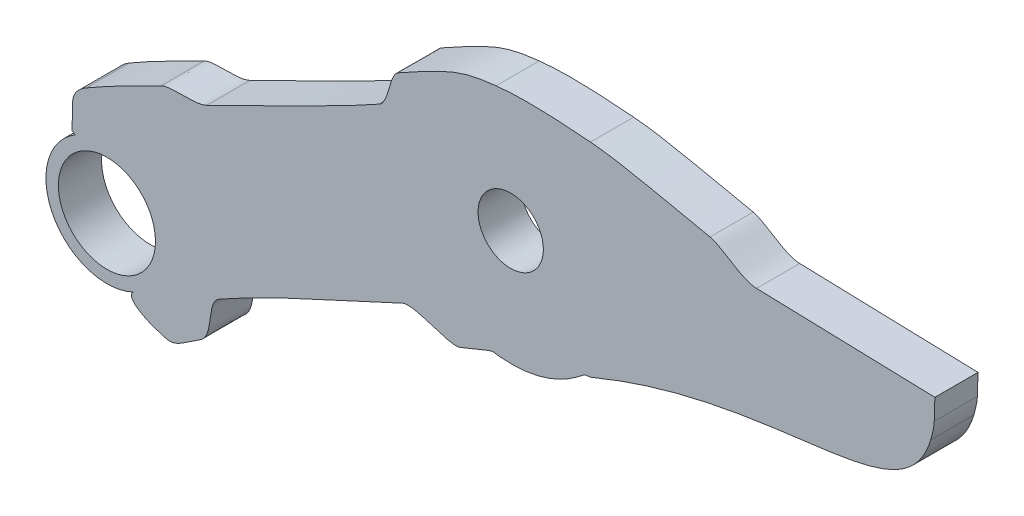
from build123d import *

# Parameters (mm, degrees)
SKETCH1_R           = 1.513948887
SKETCH1_R_2         = 2.25
BOSS_EXTRUDE1_DEPTH = 2
SCALE1_SCALE        = 2.8


with BuildPart() as part:
    # Sketch1 → Boss-Extrude1 (new body)
    with BuildSketch(Plane.XY):
        with BuildLine():
            Line((-137.330840139, 84.740646997), (-129.065622639, 84.500215059))
            Line((-129.065622639, 84.500215059), (-129.094489584, 83.519353553))
            add(Edge.make_bspline(
                [(-129.094489584, 83.519353553), (-129.101127466, 83.291204798), (-129.199889222, 82.884598348), (-129.259340655, 82.689308143)],
                knots=[0.212765957, 0.212765957, 0.212765957, 0.212765957, 0.234042553, 0.234042553, 0.234042553, 0.234042553], degree=3))
            add(Edge.make_bspline(
                [(-129.259340655, 82.689308143), (-130.523557303, 78.537033893), (-136.295329969, 80.981325314), (-144.988370325, 77.341015795)],
                knots=[0.234042553, 0.234042553, 0.234042553, 0.234042553, 0.255319149, 0.255319149, 0.255319149, 0.255319149], degree=3))
            add(Edge.make_bspline(
                [(-144.988370325, 77.341015795), (-145.098029788, 77.295108948), (-145.047490899, 77.331606959), (-145.163209238, 77.309852904)],
                knots=[0.255319149, 0.255319149, 0.255319149, 0.255319149, 0.276595745, 0.276595745, 0.276595745, 0.276595745], degree=3))
            add(Edge.make_bspline(
                [(-145.163209238, 77.309852904), (-145.220654832, 77.299037913), (-145.285896319, 77.302718732), (-145.330562439, 77.26739941)],
                knots=[0.276595745, 0.276595745, 0.276595745, 0.276595745, 0.29787234, 0.29787234, 0.29787234, 0.29787234], degree=3))
            add(Edge.make_bspline(
                [(-145.330562439, 77.26739941), (-145.851667181, 76.854361866), (-147.089249586, 75.848112745), (-149.250531504, 76.047683454)],
                knots=[0.29787234, 0.29787234, 0.29787234, 0.29787234, 0.319148936, 0.319148936, 0.319148936, 0.319148936], degree=3))
            add(Edge.make_bspline(
                [(-149.250531504, 76.047683454), (-149.579241067, 76.078019194), (-149.46315051, 76.145142448), (-149.823167715, 76.007773448)],
                knots=[0.319148936, 0.319148936, 0.319148936, 0.319148936, 0.340425532, 0.340425532, 0.340425532, 0.340425532], degree=3))
            add(Edge.make_bspline(
                [(-149.823167715, 76.007773448), (-150.230952854, 75.852269176), (-150.642170668, 75.684998689), (-151.060274508, 75.505196874)],
                knots=[0.340425532, 0.340425532, 0.340425532, 0.340425532, 0.361702128, 0.361702128, 0.361702128, 0.361702128], degree=3))
            add(Edge.make_bspline(
                [(-151.060274508, 75.505196874), (-151.574575938, 75.284016862), (-153.203689978, 76.198038715), (-153.745700946, 75.937300235)],
                knots=[0.361702128, 0.361702128, 0.361702128, 0.361702128, 0.382978723, 0.382978723, 0.382978723, 0.382978723], degree=3))
            add(Edge.make_bspline(
                [(-153.745700946, 75.937300235), (-155.594836987, 75.047762033), (-159.716630745, 73.288289093), (-162.232470675, 71.858787121)],
                knots=[0.382978723, 0.382978723, 0.382978723, 0.382978723, 0.404255319, 0.404255319, 0.404255319, 0.404255319], degree=3))
            add(Edge.make_bspline(
                [(-162.232470675, 71.858787121), (-162.860836143, 71.501768336), (-162.462583912, 70.287097997), (-163.071821528, 69.816015174)],
                knots=[0.404255319, 0.404255319, 0.404255319, 0.404255319, 0.425531915, 0.425531915, 0.425531915, 0.425531915], degree=3))
            add(Edge.make_bspline(
                [(-163.071821528, 69.816015174), (-163.094733593, 69.798293477), (-163.120271861, 69.783446128), (-163.145313839, 69.766923799)],
                knots=[0.425531915, 0.425531915, 0.425531915, 0.425531915, 0.446808511, 0.446808511, 0.446808511, 0.446808511], degree=3))
            Line((-163.145313839, 69.766923799), (-163.880340349, 69.282192995))
            add(Edge.make_bspline(
                [(-163.880340349, 69.282192995), (-164.468258164, 68.894466252), (-164.620846731, 69.006028161), (-165.195757605, 69.192653966)],
                knots=[0.468085106, 0.468085106, 0.468085106, 0.468085106, 0.489361702, 0.489361702, 0.489361702, 0.489361702], degree=3))
            add(Edge.make_bspline(
                [(-165.195757605, 69.192653966), (-165.880330422, 69.414858475), (-166.586588499, 69.876830428), (-166.216843664, 70.149863853)],
                knots=[0.489361702, 0.489361702, 0.489361702, 0.489361702, 0.509556789, 0.509556789, 0.509556789, 0.509556789], degree=3))
            ThreePointArc((-166.216843664, 70.149863853), (-169.932333673, 71.346005011), (-168.915752591, 75.114583334))
            Line((-168.915752591, 75.114583334), (-169.065622639, 75.20554687))
            Line((-169.065622639, 75.20554687), (-169.064671417, 75.244319545))
            Line((-169.064671417, 75.244319545), (-169.037168666, 76.350054178))
            add(Edge.make_bspline(
                [(-169.037168666, 76.350054178), (-169.033053593, 76.794047826), (-168.700084206, 77.078711631), (-168.409216773, 77.250221263)],
                knots=[0.957446809, 0.957446809, 0.957446809, 0.957446809, 1, 1, 1, 1], degree=3))
            add(Edge.make_bspline(
                [(-168.409216773, 77.250221263), (-167.016522993, 78.071374807), (-166.193859899, 78.40091152), (-164.934151222, 79.073281388)],
                knots=[0, 0, 0, 0, 0.021276596, 0.021276596, 0.021276596, 0.021276596], degree=3))
            add(Edge.make_bspline(
                [(-164.934151222, 79.073281388), (-164.508106737, 79.300665029), (-163.405349845, 79.062094179), (-162.816253342, 79.349694368)],
                knots=[0.021276596, 0.021276596, 0.021276596, 0.021276596, 0.042553191, 0.042553191, 0.042553191, 0.042553191], degree=3))
            add(Edge.make_bspline(
                [(-162.816253342, 79.349694368), (-160.762294186, 80.3524281), (-156.1821764, 82.606350861), (-154.813800841, 83.397685633)],
                knots=[0.042553191, 0.042553191, 0.042553191, 0.042553191, 0.063829787, 0.063829787, 0.063829787, 0.063829787], degree=3))
            add(Edge.make_bspline(
                [(-154.813800841, 83.397685633), (-154.362548949, 83.658651579), (-154.360419036, 84.858143709), (-153.955446208, 85.0823635)],
                knots=[0.063829787, 0.063829787, 0.063829787, 0.063829787, 0.085106383, 0.085106383, 0.085106383, 0.085106383], degree=3))
            add(Edge.make_bspline(
                [(-153.955446208, 85.0823635), (-151.58212429, 86.396519351), (-151.052789401, 86.655893033), (-149.40636724, 86.835736205)],
                knots=[0.085106383, 0.085106383, 0.085106383, 0.085106383, 0.106382979, 0.106382979, 0.106382979, 0.106382979], degree=3))
            add(Edge.make_bspline(
                [(-149.40636724, 86.835736205), (-148.241325924, 86.963034649), (-146.873012401, 86.919588575), (-145.02819822, 86.765759283)],
                knots=[0.106382979, 0.106382979, 0.106382979, 0.106382979, 0.127659574, 0.127659574, 0.127659574, 0.127659574], degree=3))
            add(Edge.make_bspline(
                [(-145.02819822, 86.765759283), (-143.567802181, 86.644002746), (-141.759858228, 86.186588584), (-139.486373361, 85.727582157)],
                knots=[0.127659574, 0.127659574, 0.127659574, 0.127659574, 0.14893617, 0.14893617, 0.14893617, 0.14893617], degree=3))
            add(Edge.make_bspline(
                [(-139.486373361, 85.727582157), (-138.947939819, 85.618873917), (-138.058442974, 84.761801368), (-137.330840139, 84.740646997)],
                knots=[0.14893617, 0.14893617, 0.14893617, 0.14893617, 0.170212766, 0.170212766, 0.170212766, 0.170212766], degree=3))
        make_face()
        with Locations((-148.728458674, 81.356006962)):
            Circle(SKETCH1_R, mode=Mode.SUBTRACT)
        with Locations((-167.447114441, 72.697013944)):
            Circle(SKETCH1_R_2, mode=Mode.SUBTRACT)
    extrude(amount=BOSS_EXTRUDE1_DEPTH)


with BuildPart() as part_1:
    # Scale1: scaled about (-150.446524344, 79.751047586, 1)
    add(part.part.scale(SCALE1_SCALE).moved(Location((270.803743819, -143.551885655, -1.8))))


solid = part_1.part
